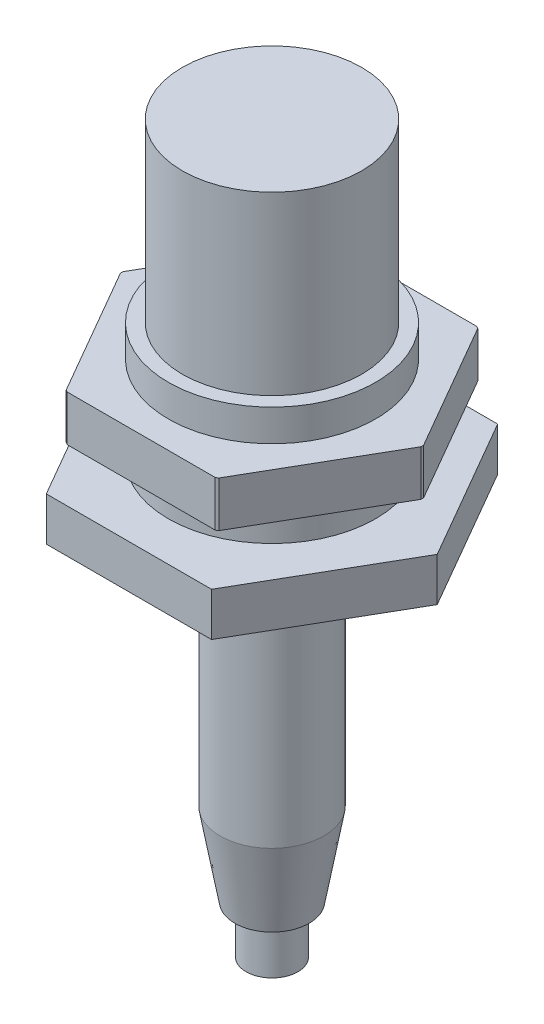
from build123d import *

# Parameters (mm, degrees)
SKETCH2_OUTSIDE_W  = 32.818
SKETCH2_OUTSIDE_H  = 32.818
CUT_EXTRUDE1_DEPTH = 2.667
CHAMFER1_SIZE      = 5.08
CHAMFER1_SIZE2     = 0.895741062
SKETCH3_OUTSIDE_W  = 32.684
SKETCH3_OUTSIDE_H  = 30.854
CUT_EXTRUDE2_DEPTH = 2.794
CUT_EXTRUDE3_START = 2.5
CUT_EXTRUDE3_DEPTH = 2.5


with BuildPart() as part:
    # Sketch1 → Revolve1 (revolve)
    with BuildSketch(Plane.XY, mode=Mode.PRIVATE) as revolve1_sk:
        Polygon((1.5875, -26.416), (1.5875, -23.495), (3.175, -23.495), (3.175, -4.445), (5.2705, -4.445), (5.2705, -2.667), (10.1219, -2.667), (10.1219, 0), (6.35, 0), (6.35, 2.5), (9.2075, 2.5), (9.2075, 5.294), (6.35, 5.294), (6.35, 7.239), (5.49275, 7.239), (5.49275, 18.034), (0, 18.034), (0, -26.416), align=None)
    revolve(revolve1_sk.sketch.rotate(Axis((0, 42.258635304, 0), (0, -1, 0)), 180), axis=Axis((0, 42.258635304, 0), (0, -1, 0)))

    # Sketch2 outside → Cut-Extrude1 (cut)
    with BuildSketch(Plane.XZ.offset(2.667)):
        Rectangle(SKETCH2_OUTSIDE_W, SKETCH2_OUTSIDE_H)
        Polygon((-5.06095, 8.765822535), (5.06095, 8.765822535), (10.1219, 0), (5.06095, -8.765822535), (-5.06095, -8.765822535), (-10.1219, 0), align=None, mode=Mode.SUBTRACT)
    extrude(amount=-CUT_EXTRUDE1_DEPTH, mode=Mode.SUBTRACT)

    # Chamfer1
    chamfer1_edges = [part.edges().sort_by_distance(p)[0] for p in [
        (3.175, -23.495, 0),
    ]]
    chamfer1_side = [part.faces().sort_by_distance(p)[0] for p in [
        (3.175, -13.97, 0),
    ]]
    chamfer(chamfer1_edges, length=CHAMFER1_SIZE, length2=CHAMFER1_SIZE2, reference=chamfer1_side[0])

    # Sketch3 outside → Cut-Extrude2 (cut)
    with BuildSketch(Plane(origin=(0, 5.294, 0), x_dir=(1, 0, 0), z_dir=(0, 1, 0))):
        Rectangle(SKETCH3_OUTSIDE_W, SKETCH3_OUTSIDE_H)
        Polygon((4.626711852, -8.0137), (9.253423704, 0), (4.626711852, 8.0137), (-4.626711852, 8.0137), (-9.253423704, 0), (-4.626711852, -8.0137), align=None, mode=Mode.SUBTRACT)
    extrude(amount=-CUT_EXTRUDE2_DEPTH, mode=Mode.SUBTRACT)

    # Sketch4 → Cut-Extrude3 (cut)
    with BuildSketch(Plane(origin=(0, 0, 0), x_dir=(1, 0, 0), z_dir=(0, 1, 0)).offset(CUT_EXTRUDE3_START)):
        with BuildLine():
            Line((-3.341032774, 5.4), (3.341032774, 5.4))
            ThreePointArc((3.341032774, 5.4), (0, 6.35), (-3.341032774, 5.4))
        make_face()
    extrude(amount=-CUT_EXTRUDE3_DEPTH, mode=Mode.SUBTRACT)


solid = part.part
